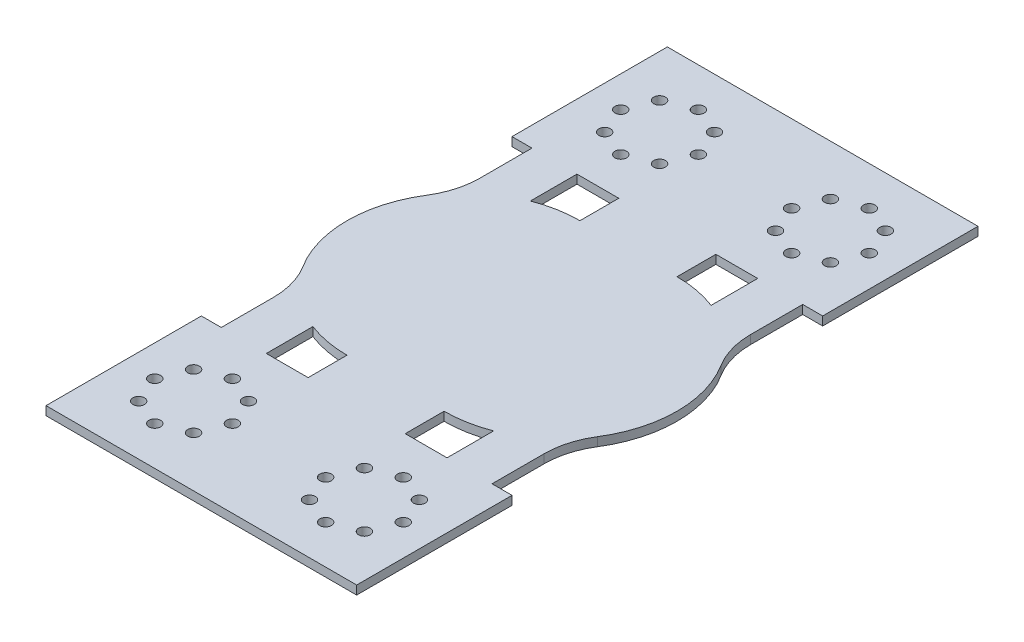
from build123d import *

# Parameters (mm, degrees)
SALIENTE_EXTRUIR1_DEPTH = 2.25
CROQUIS2_R              = 1.5
CORTAR_EXTRUIR1_DEPTH   = 128.323652555
REDONDEO1_R             = 20


with BuildPart() as part:
    # Croquis1 → Saliente-Extruir1 (new body)
    with BuildSketch(Plane(origin=(0, 0, 0), x_dir=(1, 0, 0), z_dir=(0, 1, 0))):
        with BuildLine():
            ThreePointArc((23.270329614, 12), (29.541594579, 15.310243942), (34.860679775, 20))
            ThreePointArc((34.860679775, 20), (42.5, 40), (34.860679775, 60))
            ThreePointArc((34.860679775, 60), (29.541594579, 64.689756058), (23.270329614, 68))
            ThreePointArc((23.270329614, 68), (17.977225575, 69.495762408), (12.5, 70))
            Line((12.5, 70), (12.5, 10))
            ThreePointArc((12.5, 10), (17.977225575, 10.504237592), (23.270329614, 12))
        make_face()
        Polygon((-40, 0), (-40, -40), (40, -40), (40, 0), (34.860679775, 0), (23.270329614, 0), (12.5, 0), (12.5, 10), (12.5, 70), (12.5, 80), (23.270329614, 80), (34.860679775, 80), (40, 80), (40, 120), (-40, 120), (-40, 80), (-34.860679775, 80), (-23.270329614, 80), (-12.5, 80), (-12.5, 70), (-12.5, 40), (-12.5, 10), (-12.5, 0), (-23.270329614, 0), (-34.860679775, 0), align=None)
        with BuildLine():
            ThreePointArc((-34.860679775, 60), (-42.5, 40), (-34.860679775, 20))
            ThreePointArc((-34.860679775, 20), (-29.541594579, 15.310243942), (-23.270329614, 12))
            ThreePointArc((-23.270329614, 12), (-17.977225575, 10.504237592), (-12.5, 10))
            Line((-12.5, 10), (-12.5, 40))
            Line((-12.5, 40), (-12.5, 70))
            ThreePointArc((-12.5, 70), (-17.977225575, 69.495762408), (-23.270329614, 68))
            ThreePointArc((-23.270329614, 68), (-29.541594579, 64.689756058), (-34.860679775, 60))
        make_face()
        with BuildLine():
            Line((23.270329614, 0), (34.860679775, 0))
            Line((34.860679775, 0), (34.860679775, 20))
            ThreePointArc((34.860679775, 20), (29.541594579, 15.310243942), (23.270329614, 12))
            Line((23.270329614, 12), (23.270329614, 0))
        make_face()
        with BuildLine():
            ThreePointArc((23.270329614, 68), (29.541594579, 64.689756058), (34.860679775, 60))
            Line((34.860679775, 60), (34.860679775, 80))
            Line((34.860679775, 80), (23.270329614, 80))
            Line((23.270329614, 80), (23.270329614, 68))
        make_face()
        with BuildLine():
            Line((-34.860679775, 80), (-34.860679775, 60))
            ThreePointArc((-34.860679775, 60), (-29.541594579, 64.689756058), (-23.270329614, 68))
            Line((-23.270329614, 68), (-23.270329614, 80))
            Line((-23.270329614, 80), (-34.860679775, 80))
        make_face()
        with BuildLine():
            Line((-34.860679775, 20), (-34.860679775, 0))
            Line((-34.860679775, 0), (-23.270329614, 0))
            Line((-23.270329614, 0), (-23.270329614, 12))
            ThreePointArc((-23.270329614, 12), (-29.541594579, 15.310243942), (-34.860679775, 20))
        make_face()
    extrude(amount=SALIENTE_EXTRUIR1_DEPTH)

    # Croquis2 → Cortar-Extruir1 (cut, through all)
    with BuildSketch(Plane(origin=(0, 2.25, 0), x_dir=(1, 0, 0), z_dir=(0, 1, 0))):
        with Locations(Location((32, -20, 0), (0, 0, 270))):
            Circle(CROQUIS2_R)
        with Locations(Location((29.071067812, -27.071067812, 0), (0, 0, 270))):
            Circle(CROQUIS2_R)
        with Locations(Location((22, -30, 0), (0, 0, 270))):
            Circle(CROQUIS2_R)
        with Locations(Location((14.928932188, -27.071067812, 0), (0, 0, 270))):
            Circle(CROQUIS2_R)
        with Locations(Location((12, -20, 0), (0, 0, 270))):
            Circle(CROQUIS2_R)
        with Locations(Location((14.928932188, -12.928932188, 0), (0, 0, 270))):
            Circle(CROQUIS2_R)
        with Locations(Location((22, -10, 0), (0, 0, 270))):
            Circle(CROQUIS2_R)
        with Locations(Location((29.071067812, -12.928932188, 0), (0, 0, 270))):
            Circle(CROQUIS2_R)
        with Locations(Location((-29.071067812, -12.928932188, 0), (0, 0, 90))):
            Circle(CROQUIS2_R)
        with Locations(Location((-22, -10, 0), (0, 0, 90))):
            Circle(CROQUIS2_R)
        with Locations(Location((-14.928932188, -12.928932188, 0), (0, 0, 90))):
            Circle(CROQUIS2_R)
        with Locations(Location((-12, -20, 0), (0, 0, 90))):
            Circle(CROQUIS2_R)
        with Locations(Location((-14.928932188, -27.071067812, 0), (0, 0, 90))):
            Circle(CROQUIS2_R)
        with Locations(Location((-22, -30, 0), (0, 0, 90))):
            Circle(CROQUIS2_R)
        with Locations(Location((-29.071067812, -27.071067812, 0), (0, 0, 90))):
            Circle(CROQUIS2_R)
        with Locations(Location((-32, -20, 0), (0, 0, 90))):
            Circle(CROQUIS2_R)
        with Locations(Location((-32, 100, 0), (0, 0, 270))):
            Circle(CROQUIS2_R)
        with Locations(Location((-29.071067812, 107.071067812, 0), (0, 0, 270))):
            Circle(CROQUIS2_R)
        with Locations(Location((-22, 110, 0), (0, 0, 270))):
            Circle(CROQUIS2_R)
        with Locations(Location((-14.928932188, 107.071067812, 0), (0, 0, 270))):
            Circle(CROQUIS2_R)
        with Locations(Location((-12, 100, 0), (0, 0, 270))):
            Circle(CROQUIS2_R)
        with Locations(Location((-14.928932188, 92.928932188, 0), (0, 0, 270))):
            Circle(CROQUIS2_R)
        with Locations(Location((-22, 90, 0), (0, 0, 270))):
            Circle(CROQUIS2_R)
        with Locations(Location((-29.071067812, 92.928932188, 0), (0, 0, 270))):
            Circle(CROQUIS2_R)
        with Locations(Location((29.071067812, 92.928932188, 0), (0, 0, 90))):
            Circle(CROQUIS2_R)
        with Locations(Location((22, 90, 0), (0, 0, 90))):
            Circle(CROQUIS2_R)
        with Locations(Location((14.928932188, 92.928932188, 0), (0, 0, 90))):
            Circle(CROQUIS2_R)
        with Locations(Location((12, 100, 0), (0, 0, 90))):
            Circle(CROQUIS2_R)
        with Locations(Location((14.928932188, 107.071067812, 0), (0, 0, 90))):
            Circle(CROQUIS2_R)
        with Locations(Location((22, 110, 0), (0, 0, 90))):
            Circle(CROQUIS2_R)
        with Locations(Location((29.071067812, 107.071067812, 0), (0, 0, 90))):
            Circle(CROQUIS2_R)
        with Locations(Location((32, 100, 0), (0, 0, 90))):
            Circle(CROQUIS2_R)
    extrude(amount=-CORTAR_EXTRUIR1_DEPTH, mode=Mode.SUBTRACT)

    # Redondeo1
    redondeo1_edges = [part.edges().sort_by_distance(p)[0] for p in [
        (34.860679775, 1.125, -60),
        (34.860679775, 1.125, -20),
        (-34.860679775, 1.125, -20),
        (-34.860679775, 1.125, -60),
    ]]
    fillet(redondeo1_edges, radius=REDONDEO1_R)


solid = part.part
